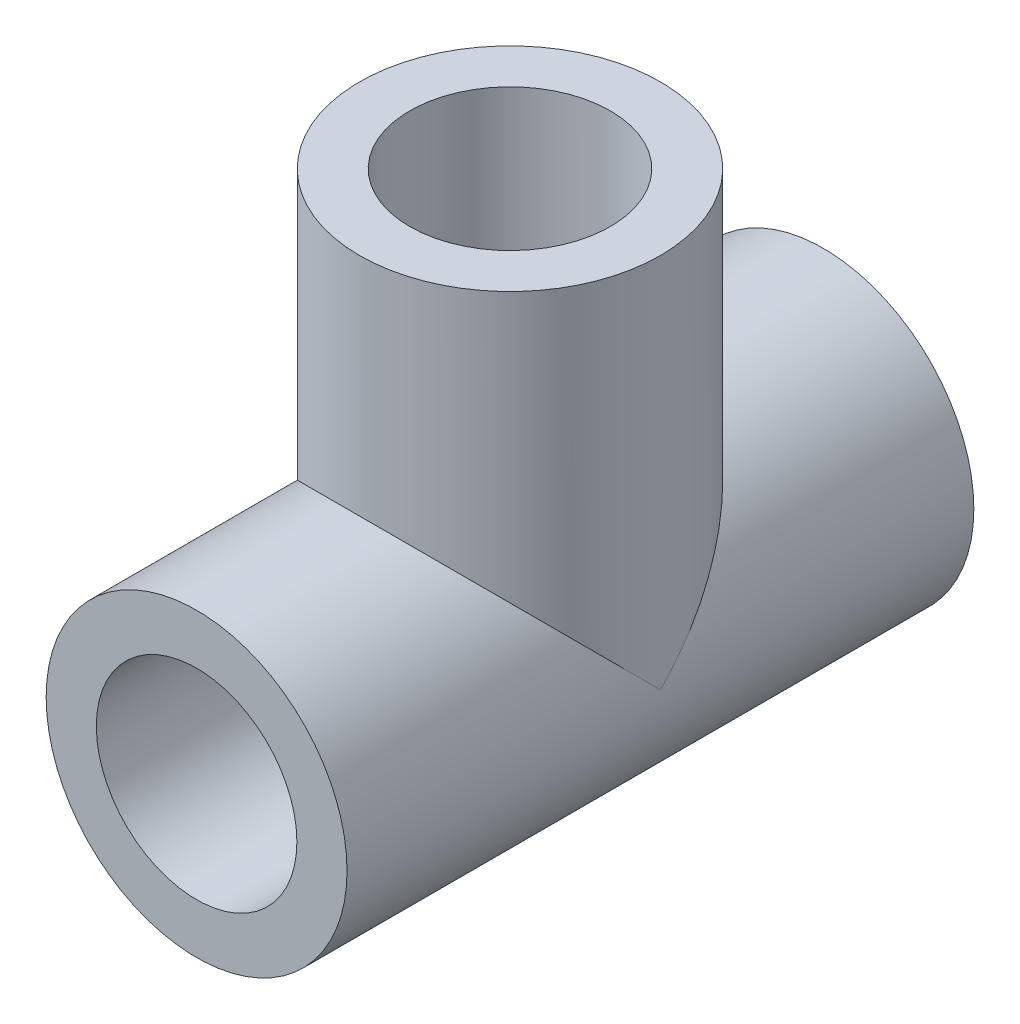
from build123d import *

# Parameters (mm, degrees)
SKETCH1_R           = 6
SKETCH1_R_2         = 4
BOSS_EXTRUDE1_DEPTH = 12.5
SKETCH2_R           = 6
SKETCH2_R_2         = 4
BOSS_EXTRUDE2_DEPTH = 15
CUT_EXTRUDE1_START  = -25
SKETCH3_R           = 4
CUT_EXTRUDE1_DEPTH  = 25


with BuildPart() as part:
    # Sketch1 → Boss-Extrude1 (new, symmetric)
    with BuildSketch(Plane.XY):
        Circle(SKETCH1_R)
        Circle(SKETCH1_R_2, mode=Mode.SUBTRACT)
    extrude(amount=BOSS_EXTRUDE1_DEPTH, both=True)

    # Sketch2 → Boss-Extrude2 (add)
    with BuildSketch(Plane(origin=(0, 0, 0), x_dir=(1, 0, 0), z_dir=(0, 1, 0))):
        Circle(SKETCH2_R)
        with Locations(Location((0, 0, 0), (0, 0, 90))):
            Circle(SKETCH2_R_2, mode=Mode.SUBTRACT)
    extrude(amount=BOSS_EXTRUDE2_DEPTH)

    # Sketch3 → Cut-Extrude1 (cut)
    with BuildSketch(Plane.XY.offset(12.5).offset(CUT_EXTRUDE1_START)):
        Circle(SKETCH3_R)
    extrude(amount=CUT_EXTRUDE1_DEPTH, mode=Mode.SUBTRACT)


solid = part.part
